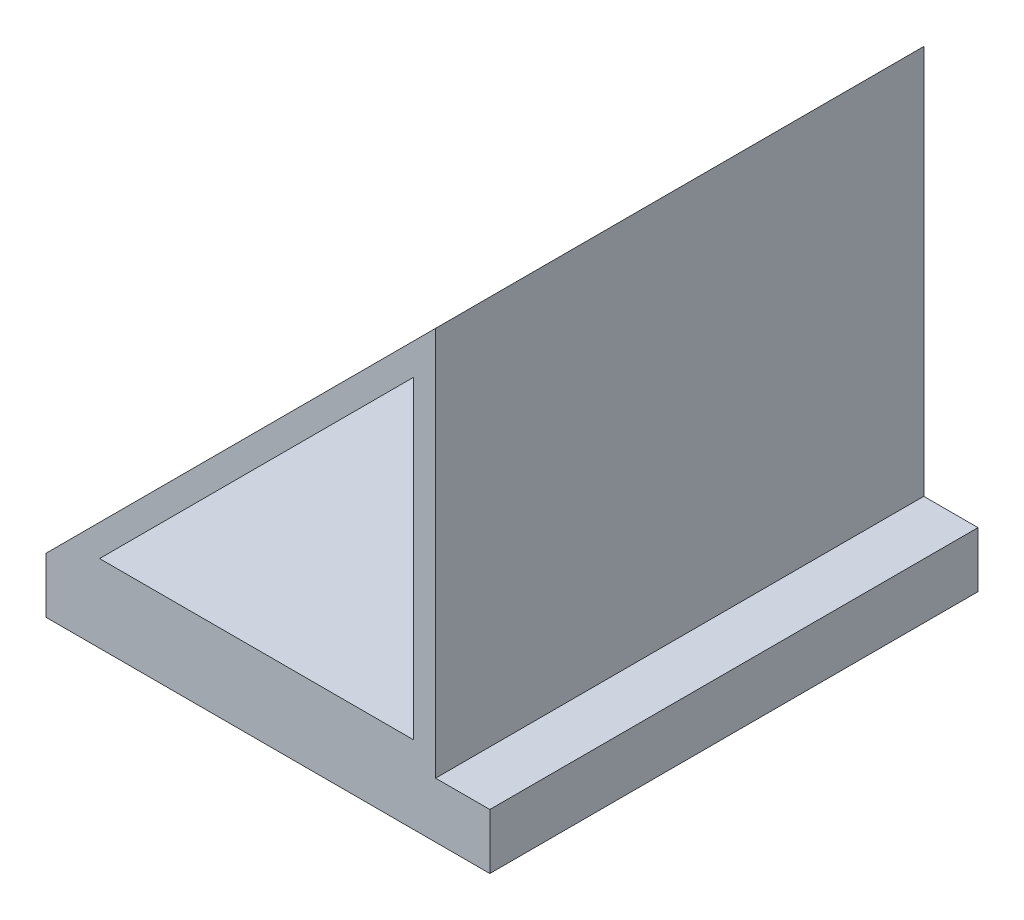
from build123d import *

# Parameters (mm, degrees)
BOSS_EXTRUDE1_DEPTH = 44
CUT_EXTRUDE1_REACH  = 64.814
SKETCH2_R           = 1.5
SKETCH2_R_2         = 17
SKETCH3_W           = 40
SKETCH3_H           = 5
BOSS_EXTRUDE2_DEPTH = 44


with BuildPart() as part:
    # Sketch1 → Boss-Extrude1 (new body)
    with BuildSketch(Plane.XY):
        Polygon((2, 4.828427125), (-33.112698372, -30.284271247), (2, -30.284271247), align=None)
        Polygon((0, 0), (-28.284271247, -28.284271247), (0, -28.284271247), align=None, mode=Mode.SUBTRACT)
    extrude(amount=BOSS_EXTRUDE1_DEPTH)

    # Sketch2 → Cut-Extrude1 (cut, up to next)
    with BuildSketch(Plane(origin=(-1.414213562, 1.414213562, 0), x_dir=(0, 0, 1), z_dir=(-0.7071067811865513, 0.7071067811865437, 0)), mode=Mode.PRIVATE) as cut_extrude1_sk1:
        with Locations(Location((6, -36, 0), (0, 0, 270))):
            Circle(SKETCH2_R)
    cut_extrude1_tool1 = extrude(cut_extrude1_sk1.sketch, amount=-CUT_EXTRUDE1_REACH, mode=Mode.PRIVATE) & part.part
    # Sketch2 → Cut-Extrude1 (cut, up to next)
    with BuildSketch(Plane(origin=(-1.414213562, 1.414213562, 0), x_dir=(0, 0, 1), z_dir=(-0.7071067811865513, 0.7071067811865437, 0)), mode=Mode.PRIVATE) as cut_extrude1_sk2:
        with Locations(Location((6, -4, 0), (0, 0, 270))):
            Circle(SKETCH2_R)
    cut_extrude1_tool2 = extrude(cut_extrude1_sk2.sketch, amount=-CUT_EXTRUDE1_REACH, mode=Mode.PRIVATE) & part.part
    # Sketch2 → Cut-Extrude1 (cut, up to next)
    with BuildSketch(Plane(origin=(-1.414213562, 1.414213562, 0), x_dir=(0, 0, 1), z_dir=(-0.7071067811865513, 0.7071067811865437, 0)), mode=Mode.PRIVATE) as cut_extrude1_sk3:
        with Locations(Location((38, -36, 0), (0, 0, 270))):
            Circle(SKETCH2_R)
    cut_extrude1_tool3 = extrude(cut_extrude1_sk3.sketch, amount=-CUT_EXTRUDE1_REACH, mode=Mode.PRIVATE) & part.part
    # Sketch2 → Cut-Extrude1 (cut, up to next)
    with BuildSketch(Plane(origin=(-1.414213562, 1.414213562, 0), x_dir=(0, 0, 1), z_dir=(-0.7071067811865513, 0.7071067811865437, 0)), mode=Mode.PRIVATE) as cut_extrude1_sk4:
        with Locations(Location((38, -4, 0), (0, 0, 270))):
            Circle(SKETCH2_R)
    cut_extrude1_tool4 = extrude(cut_extrude1_sk4.sketch, amount=-CUT_EXTRUDE1_REACH, mode=Mode.PRIVATE) & part.part
    # Sketch2 → Cut-Extrude1 (cut, up to next)
    with BuildSketch(Plane(origin=(-1.414213562, 1.414213562, 0), x_dir=(0, 0, 1), z_dir=(-0.7071067811865513, 0.7071067811865437, 0)), mode=Mode.PRIVATE) as cut_extrude1_sk5:
        with Locations(Location((22, -20, 0), (0, 0, 270))):
            Circle(SKETCH2_R_2)
    cut_extrude1_tool5 = extrude(cut_extrude1_sk5.sketch, amount=-CUT_EXTRUDE1_REACH, mode=Mode.PRIVATE) & part.part
    add(cut_extrude1_tool1.solids().sort_by_distance((-26.870058, -24.041631, 6))[0], mode=Mode.SUBTRACT)
    add(cut_extrude1_tool2.solids().sort_by_distance((-4.242641, -1.414214, 6))[0], mode=Mode.SUBTRACT)
    add(cut_extrude1_tool3.solids().sort_by_distance((-26.870058, -24.041631, 38))[0], mode=Mode.SUBTRACT)
    add(cut_extrude1_tool4.solids().sort_by_distance((-4.242641, -1.414214, 38))[0], mode=Mode.SUBTRACT)
    add(cut_extrude1_tool5.solids().sort_by_distance((-15.556349, -12.727922, 22))[0], mode=Mode.SUBTRACT)

    # Sketch3 → Boss-Extrude2 (add)
    with BuildSketch(Plane.XY):
        with Locations((-13.112698372, -32.784271247)):
            Rectangle(SKETCH3_W, SKETCH3_H)
    extrude(amount=BOSS_EXTRUDE2_DEPTH)


solid = part.part
